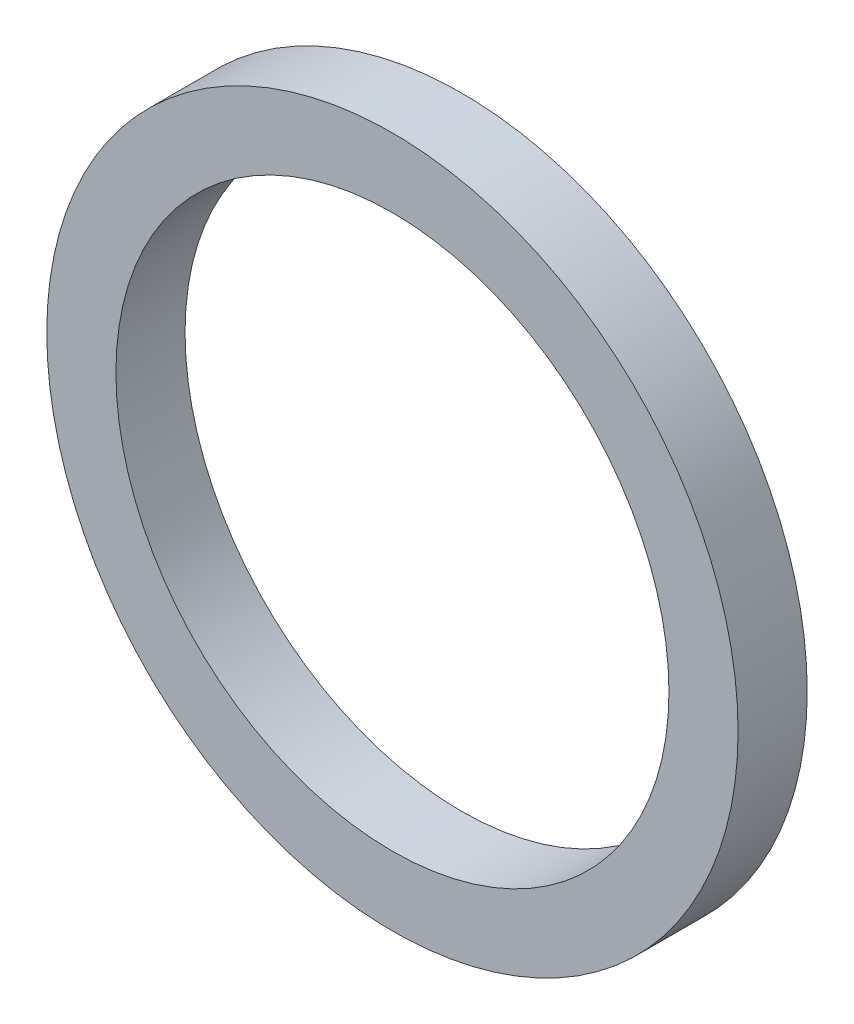
from build123d import *

# Parameters (mm, degrees)
SKETCH_1_R      = 5
SKETCH_1_R_2    = 4
EXTRUDE_1_DEPTH = 1


with BuildPart() as part:
    # 草图1 → 凸台-拉伸1 (new body)
    with BuildSketch(Plane.XY):
        Circle(SKETCH_1_R)
        Circle(SKETCH_1_R_2, mode=Mode.SUBTRACT)
    extrude(amount=EXTRUDE_1_DEPTH)


solid = part.part
